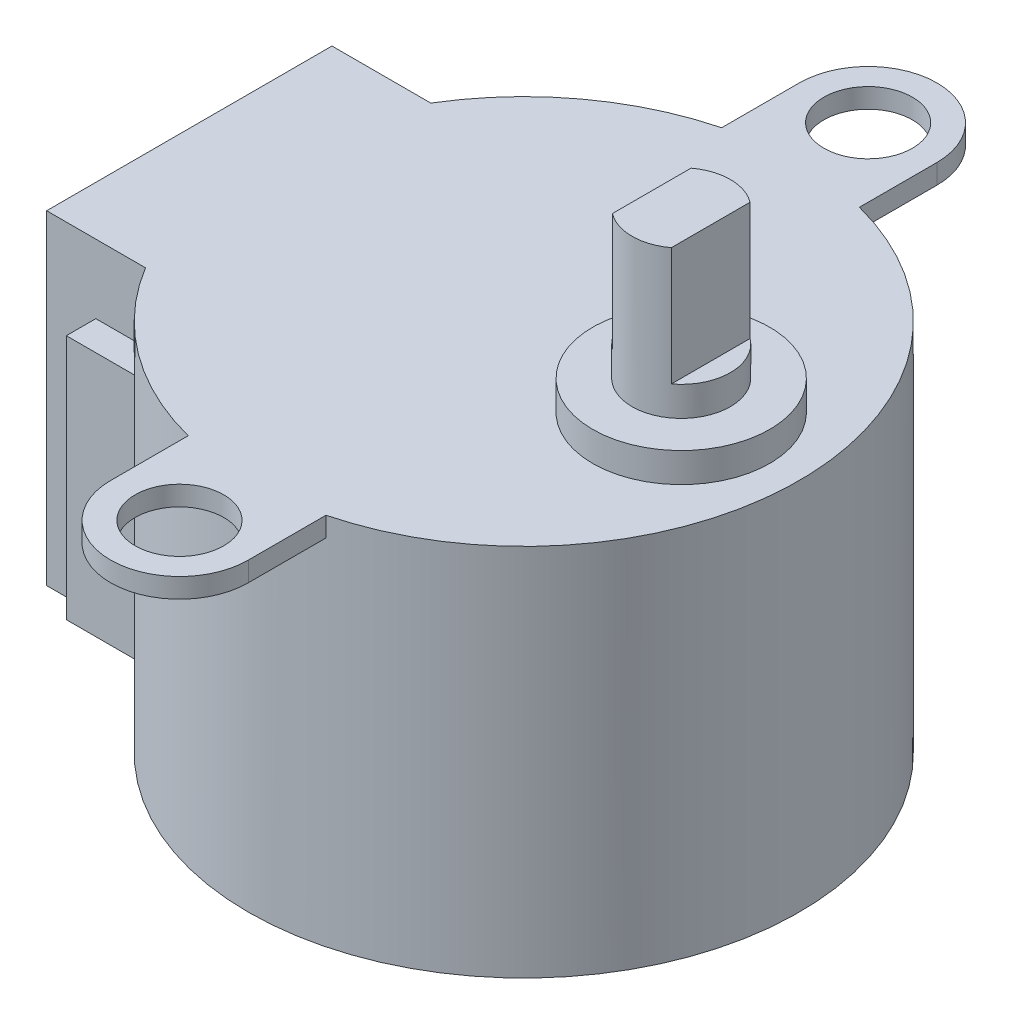
from build123d import *

# Parameters (mm, degrees)
EXTRUDE_1_DEPTH   = 9
EXTRUDE_2_DEPTH   = 3
EXTRUDE_3_DEPTH   = 1.5
SKETCH_1_7_R      = 2.25
EXTRUDE_4_DEPTH   = 1
EXTRUDE_4_2_DEPTH = 1
SKETCH_1_8_R      = 14
EXTRUDE_5_DEPTH   = 19
EXTRUDE_6_DEPTH   = 16.5
EXTRUDE_START     = -3.5
EXTRUDE_7_DEPTH   = 12.5


with BuildPart() as part:
    # Эскиз1 → Бобышка-Вытянуть1 (new body)
    with BuildSketch(Plane(origin=(0, 0, 0), x_dir=(1, 0, 0), z_dir=(0, 1, 0))):
        with BuildLine():
            ThreePointArc((9.5, 2), (8, 2.5), (6.5, 2))
            Line((6.5, 2), (6.5, -2))
            ThreePointArc((6.5, -2), (8, -2.5), (9.5, -2))
            Line((9.5, -2), (9.5, 2))
        make_face()
    extrude(amount=EXTRUDE_1_DEPTH)

    # Эскиз1<4> → Бобышка-Вытянуть2 (add)
    with BuildSketch(Plane(origin=(0, 0, 0), x_dir=(1, 0, 0), z_dir=(0, 1, 0))):
        with BuildLine():
            Line((6.5, -2), (6.5, 2))
            ThreePointArc((6.5, 2), (5.5, 0), (6.5, -2))
        make_face()
        with BuildLine():
            ThreePointArc((9.5, -2), (10.5, 0), (9.5, 2))
            Line((9.5, 2), (9.5, -2))
        make_face()
    extrude(amount=EXTRUDE_2_DEPTH)

    # Эскиз1<5> → Бобышка-Вытянуть3 (add)
    with BuildSketch(Plane(origin=(0, 0, 0), x_dir=(1, 0, 0), z_dir=(0, 1, 0))):
        with BuildLine():
            ThreePointArc((12.5, 0), (8.000000009, 4.5), (3.5, 1.8e-08))
            ThreePointArc((3.5, 1.8e-08), (7.999999991, -4.5), (12.5, 0))
        make_face()
        with BuildLine():
            ThreePointArc((6.5, -2), (5.5, 0), (6.5, 2))
            ThreePointArc((6.5, 2), (8, 2.5), (9.5, 2))
            ThreePointArc((9.5, 2), (10.236067977, 1.118033989), (10.5, 0))
            ThreePointArc((10.5, 0), (10.236067977, -1.118033989), (9.5, -2))
            ThreePointArc((9.5, -2), (8, -2.5), (6.5, -2))
        make_face(mode=Mode.SUBTRACT)
    extrude(amount=EXTRUDE_3_DEPTH)



with BuildPart() as body_2:
    # Эскиз1<7> → Бобышка-Вытянуть4 (new body)
    with BuildSketch(Plane(origin=(0, 0, 0), x_dir=(1, 0, 0), z_dir=(0, 1, 0))):
        with BuildLine():
            Line((-3.5, 17.5), (-3.5, 13.555441712))
            ThreePointArc((-3.5, 13.555441712), (0, 14), (3.5, 13.555441712))
            Line((3.5, 13.555441712), (3.5, 17.5))
            ThreePointArc((3.5, 17.5), (0, 21), (-3.5, 17.5))
        make_face()
        with Locations((0, 17.5)):
            Circle(SKETCH_1_7_R, mode=Mode.SUBTRACT)
    extrude(amount=-EXTRUDE_4_DEPTH)


with BuildPart() as body_3:
    # Эскиз1<7> → Extrude 4 2 (new body)
    with BuildSketch(Plane(origin=(0, 0, 0), x_dir=(1, 0, 0), z_dir=(0, 1, 0))):
        with BuildLine():
            Line((-3.5, -13.555441712), (-3.5, -17.5))
            ThreePointArc((-3.5, -17.5), (0, -21), (3.5, -17.5))
            Line((3.5, -17.5), (3.5, -13.555441712))
            ThreePointArc((3.5, -13.555441712), (0, -14), (-3.5, -13.555441712))
        make_face()
        with Locations((0, -17.5)):
            Circle(SKETCH_1_7_R, mode=Mode.SUBTRACT)
    extrude(amount=-EXTRUDE_4_2_DEPTH)


with BuildPart() as part_1:
    add(part.part)

    add(body_2.part)  # Бобышка-Вытянуть5 merges body 2

    add(body_3.part)  # Бобышка-Вытянуть5 merges body 3
    # Эскиз1<8> → Бобышка-Вытянуть5 (add)
    with BuildSketch(Plane(origin=(0, 0, 0), x_dir=(1, 0, 0), z_dir=(0, 1, 0))):
        Circle(SKETCH_1_8_R)
    extrude(amount=-EXTRUDE_5_DEPTH)

    # Эскиз1<9> → Бобышка-Вытянуть6 (add)
    with BuildSketch(Plane(origin=(0, 0, 0), x_dir=(1, 0, 0), z_dir=(0, 1, 0))):
        with BuildLine():
            ThreePointArc((-11.976539567, -7.25), (-14, 0), (-11.976539567, 7.25))
            Line((-11.976539567, 7.25), (-17, 7.25))
            Line((-17, 7.25), (-17, -7.25))
            Line((-17, -7.25), (-11.976539567, -7.25))
        make_face()
    extrude(amount=-EXTRUDE_6_DEPTH)

    # Эскиз1<10> → Бобышка-Вытянуть7 (add)
    with BuildSketch(Plane(origin=(0, 0, 0), x_dir=(1, 0, 0), z_dir=(0, 1, 0)).offset(EXTRUDE_START)):
        with BuildLine():
            ThreePointArc((-11.976539567, 7.25), (-11.477174409, 8.017135871), (-10.928746497, 8.75))
            Line((-10.928746497, 8.75), (-14.5, 8.75))
            Line((-14.5, 8.75), (-14.5, 7.25))
            Line((-14.5, 7.25), (-11.976539567, 7.25))
        make_face()
        with BuildLine():
            ThreePointArc((-10.928746497, -8.75), (-11.477174409, -8.017135871), (-11.976539567, -7.25))
            Line((-11.976539567, -7.25), (-14.5, -7.25))
            Line((-14.5, -7.25), (-14.5, -8.75))
            Line((-14.5, -8.75), (-10.928746497, -8.75))
        make_face()
    extrude(amount=-EXTRUDE_7_DEPTH)


solid = part_1.part
